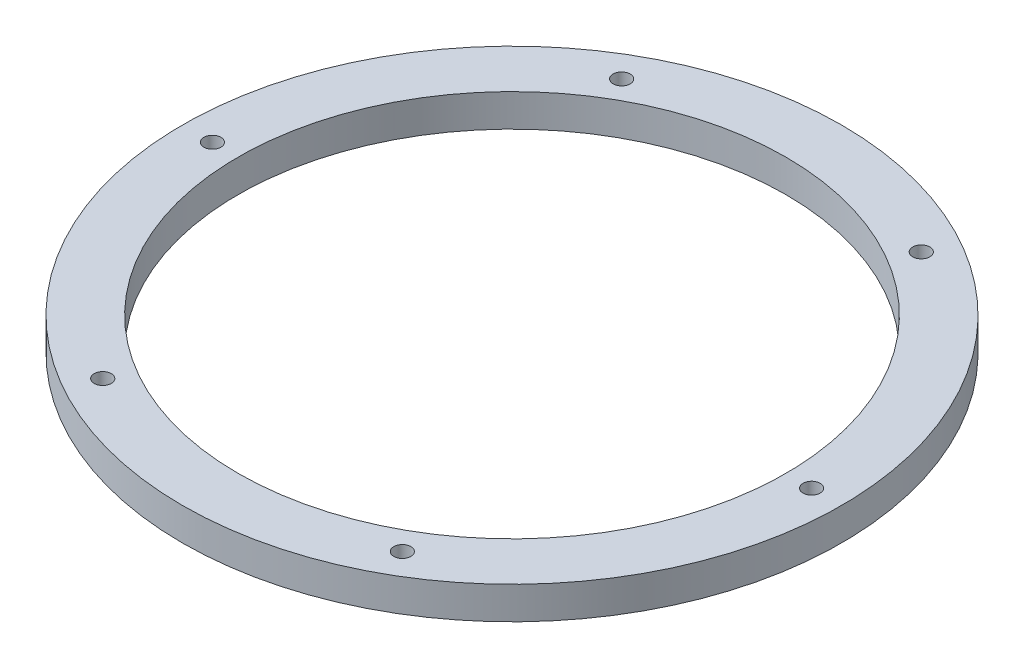
from build123d import *

# Parameters (mm, degrees)
SKETCH1_R           = 192.5
SKETCH1_R_2         = 160
SKETCH1_R_3         = 5
BOSS_EXTRUDE1_DEPTH = 9.5


with BuildPart() as part:
    # Sketch1 → Boss-Extrude1 (new, symmetric)
    with BuildSketch(Plane(origin=(0, 0, 0), x_dir=(1, 0, 0), z_dir=(0, 1, 0))):
        with Locations(Location((0, 0, 0), (0, 0, 270))):
            Circle(SKETCH1_R)
        with Locations(Location((0, 0, 0), (0, 0, 270))):
            Circle(SKETCH1_R_2, mode=Mode.SUBTRACT)
        with Locations(Location((-87.5, 151.554445662, 0), (0, 0, 270))):
            Circle(SKETCH1_R_3, mode=Mode.SUBTRACT)
        with Locations(Location((-175, 0, 0), (0, 0, 270))):
            Circle(SKETCH1_R_3, mode=Mode.SUBTRACT)
        with Locations(Location((87.5, 151.554445662, 0), (0, 0, 270))):
            Circle(SKETCH1_R_3, mode=Mode.SUBTRACT)
        with Locations(Location((175, 0, 0), (0, 0, 270))):
            Circle(SKETCH1_R_3, mode=Mode.SUBTRACT)
        with Locations(Location((87.5, -151.554445662, 0), (0, 0, 90))):
            Circle(SKETCH1_R_3, mode=Mode.SUBTRACT)
        with Locations(Location((-87.5, -151.554445662, 0), (0, 0, 90))):
            Circle(SKETCH1_R_3, mode=Mode.SUBTRACT)
    extrude(amount=BOSS_EXTRUDE1_DEPTH, both=True)


solid = part.part
